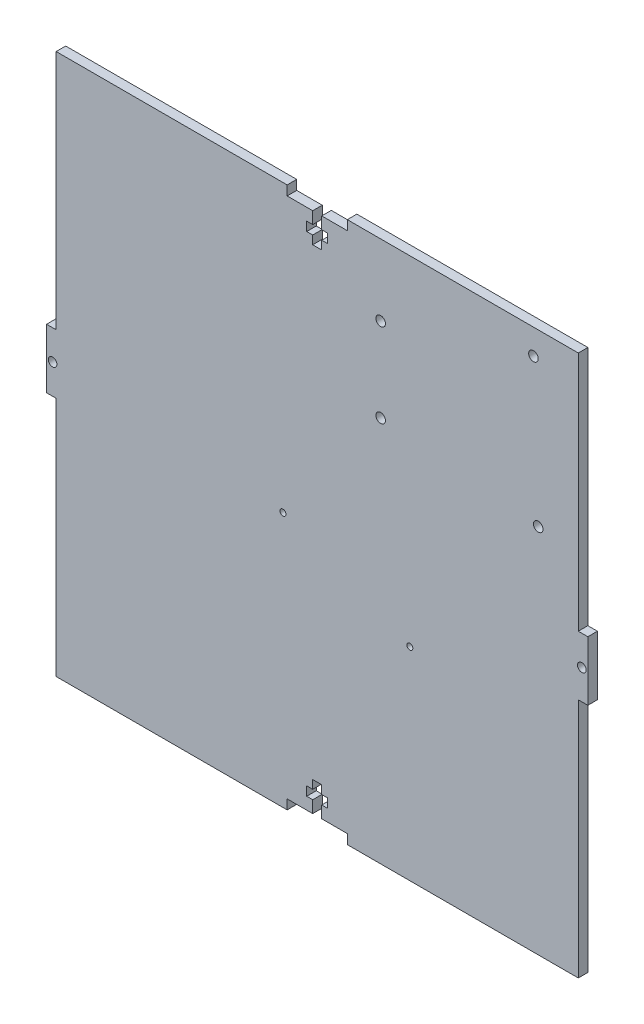
from build123d import *

# Parameters (mm, degrees)
SKETCH3_W           = 180
SKETCH3_H           = 180
SKETCH3_R           = 1
SKETCH3_R_2         = 1.59
BOSS_EXTRUDE1_DEPTH = 3.18
CUT_EXTRUDE1_DEPTH  = 128.318939675
SKETCH5_R           = 1.436023081
SKETCH5_W           = 3.18
SKETCH5_H           = 80.125
CUT_EXTRUDE2_DEPTH  = 128.318939675


with BuildPart() as part:
    # Sketch3 → Boss-Extrude1 (new body)
    with BuildSketch(Plane.XY):
        Rectangle(SKETCH3_W, SKETCH3_H)
        with Locations(Location((-11.39889268, -5.07556396, 0), (0, 0, 180))):
            Circle(SKETCH3_R, mode=Mode.SUBTRACT)
        with Locations(Location((30.80110732, -22.57556396, 0), (0, 0, 180))):
            Circle(SKETCH3_R, mode=Mode.SUBTRACT)
        with Locations(Location((73.5, 33.341660125, 0), (0, 0, 180))):
            Circle(SKETCH3_R_2, mode=Mode.SUBTRACT)
        with Locations(Location((21.1, 38.441660125, 0), (0, 0, 180))):
            Circle(SKETCH3_R_2, mode=Mode.SUBTRACT)
        with Locations(Location((21.1, 66.341660125, 0), (0, 0, 180))):
            Circle(SKETCH3_R_2, mode=Mode.SUBTRACT)
        with Locations(Location((71.9, 81.641660125, 0), (0, 0, 180))):
            Circle(SKETCH3_R_2, mode=Mode.SUBTRACT)
    extrude(amount=BOSS_EXTRUDE1_DEPTH)

    # Sketch4 → Cut-Extrude1 (cut, through all)
    with BuildSketch(Plane.XY.offset(3.18)):
        Polygon((1.5, 86.82), (10, 86.82), (10, 90), (-10, 90), (-10, 86.82), (-1.5, 86.82), (-1.5, 82.82), (-3.5, 82.82), (-3.5, 79.82), (-1.5, 79.82), (-1.5, 77), (1.5, 77), (1.5, 79.82), (3.5, 79.82), (3.5, 82.82), (1.5, 82.82), align=None)
        Polygon((1.5, -79.82), (1.5, -77), (-1.5, -77), (-1.5, -79.82), (-3.5, -79.82), (-3.5, -82.82), (-1.5, -82.82), (-1.5, -86.82), (-10, -86.82), (-10, -90), (10, -90), (10, -86.82), (1.5, -86.82), (1.5, -82.82), (3.5, -82.82), (3.5, -79.82), align=None)
    extrude(amount=-CUT_EXTRUDE1_DEPTH, mode=Mode.SUBTRACT)

    # Sketch5 → Cut-Extrude2 (cut, through all)
    with BuildSketch(Plane.XY.offset(3.18)):
        with Locations((-88, 0)):
            Circle(SKETCH5_R)
        with Locations((88, 0)):
            Circle(SKETCH5_R)
        with Locations((-88.41, 49.9375)):
            Rectangle(SKETCH5_W, SKETCH5_H)
        with Locations((-88.41, -49.9375)):
            Rectangle(SKETCH5_W, SKETCH5_H)
        with Locations((88.41, -49.9375)):
            Rectangle(SKETCH5_W, SKETCH5_H)
        with Locations((88.41, 49.9375)):
            Rectangle(SKETCH5_W, SKETCH5_H)
    extrude(amount=-CUT_EXTRUDE2_DEPTH, mode=Mode.SUBTRACT)


solid = part.part
